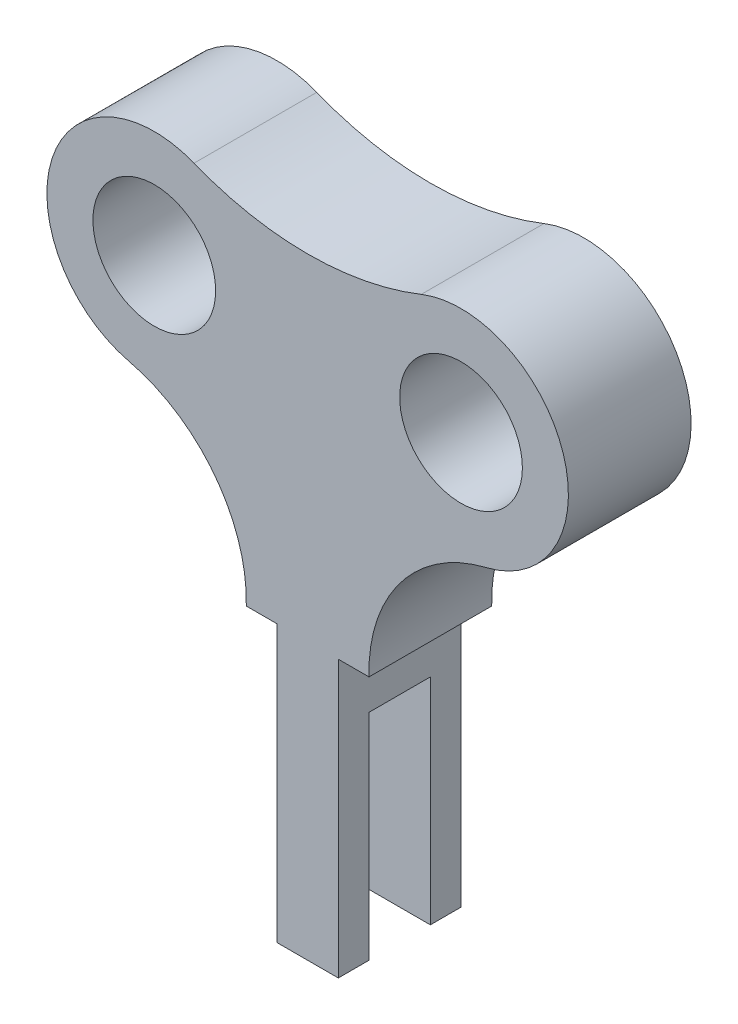
from build123d import *

# Parameters (mm, degrees)
BOSS_EXTRUDE1_DEPTH      = 10
BOSS_EXTRUDE1_DEPTH_BACK = 10
SKETCH3_R                = 10
SKETCH6_W                = 10
SKETCH6_H                = 10
CUT_EXTRUDE1_DEPTH       = 35


with BuildPart() as part:
    # Sketch3 → Boss-Extrude1 (new, two sides: drawn at the far end of the back side and taken through both)
    with BuildSketch(Plane.XY.offset(-BOSS_EXTRUDE1_DEPTH_BACK)):
        with BuildLine():
            Line((5, -50.100820454), (-5, -50.100820454))
            Line((-5, -50.100820454), (-5, -5.100820454))
            Line((-5, -5.100820454), (-10, -5.100820454))
            ThreePointArc((-10, -5.100820454), (-15.132819854, 10.778061575), (-29.113715132, 19.889554394))
            ThreePointArc((-29.113715132, 19.889554394), (-41.674629404, 42.210180792), (-18.518518519, 53.154652403))
            ThreePointArc((-18.518518519, 53.154652403), (0, 49.598860566), (18.518518519, 53.154652403))
            ThreePointArc((18.518518519, 53.154652403), (41.674629404, 42.210180792), (29.113715132, 19.889554394))
            ThreePointArc((29.113715132, 19.889554394), (15.132819854, 10.778061575), (10, -5.100820454))
            Line((10, -5.100820454), (5, -5.100820454))
            Line((5, -5.100820454), (5, -50.100820454))
        make_face()
        with Locations((-25, 36.899179546)):
            Circle(SKETCH3_R, mode=Mode.SUBTRACT)
        with Locations((25, 36.899179546)):
            Circle(SKETCH3_R, mode=Mode.SUBTRACT)
    extrude(amount=BOSS_EXTRUDE1_DEPTH + BOSS_EXTRUDE1_DEPTH_BACK)

    # Sketch6 → Cut-Extrude1 (cut)
    with BuildSketch(Plane.XZ.offset(50.100820454)):
        Rectangle(SKETCH6_W, SKETCH6_H)
    extrude(amount=-CUT_EXTRUDE1_DEPTH, mode=Mode.SUBTRACT)


solid = part.part
